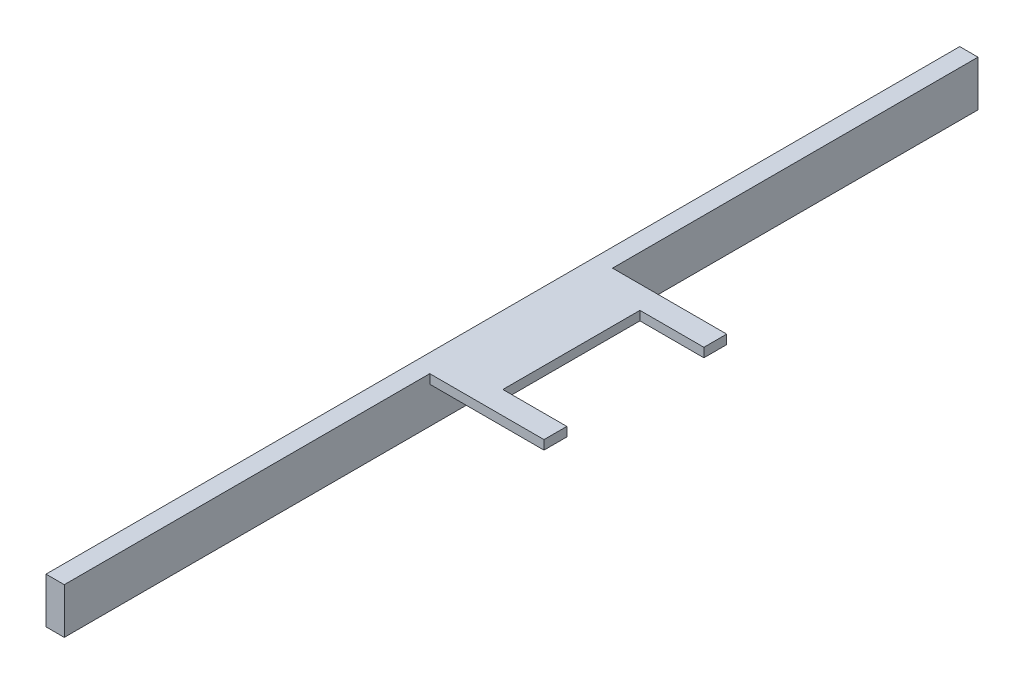
from build123d import *

# Parameters (mm, degrees)
SALIENTE_EXTRUIR1_DEPTH = 100
CROQUIS2_W              = 7
CROQUIS2_H              = 15
CROQUIS2_W_2            = 12.5
CROQUIS2_H_2            = 40
CORTAR_EXTRUIR1_DEPTH   = 11


with BuildPart() as part:
    # Croquis1 → Saliente-Extruir1 (new body)
    with BuildSketch(Plane.XY):
        Polygon((0, 0), (2, 0), (2, 4), (14.5, 4), (14.5, 5), (2, 5), (0, 5), align=None)
    extrude(amount=SALIENTE_EXTRUIR1_DEPTH)

    # Croquis2 → Cortar-Extruir1 (cut)
    with BuildSketch(Plane(origin=(0, 5, 0), x_dir=(1, 0, 0), z_dir=(0, 1, 0))):
        with Locations((11, -50)):
            Rectangle(CROQUIS2_W, CROQUIS2_H)
        with Locations((8.25, -20)):
            Rectangle(CROQUIS2_W_2, CROQUIS2_H_2)
        with Locations((8.25, -80)):
            Rectangle(CROQUIS2_W_2, CROQUIS2_H_2)
    extrude(amount=-CORTAR_EXTRUIR1_DEPTH, mode=Mode.SUBTRACT)


solid = part.part
